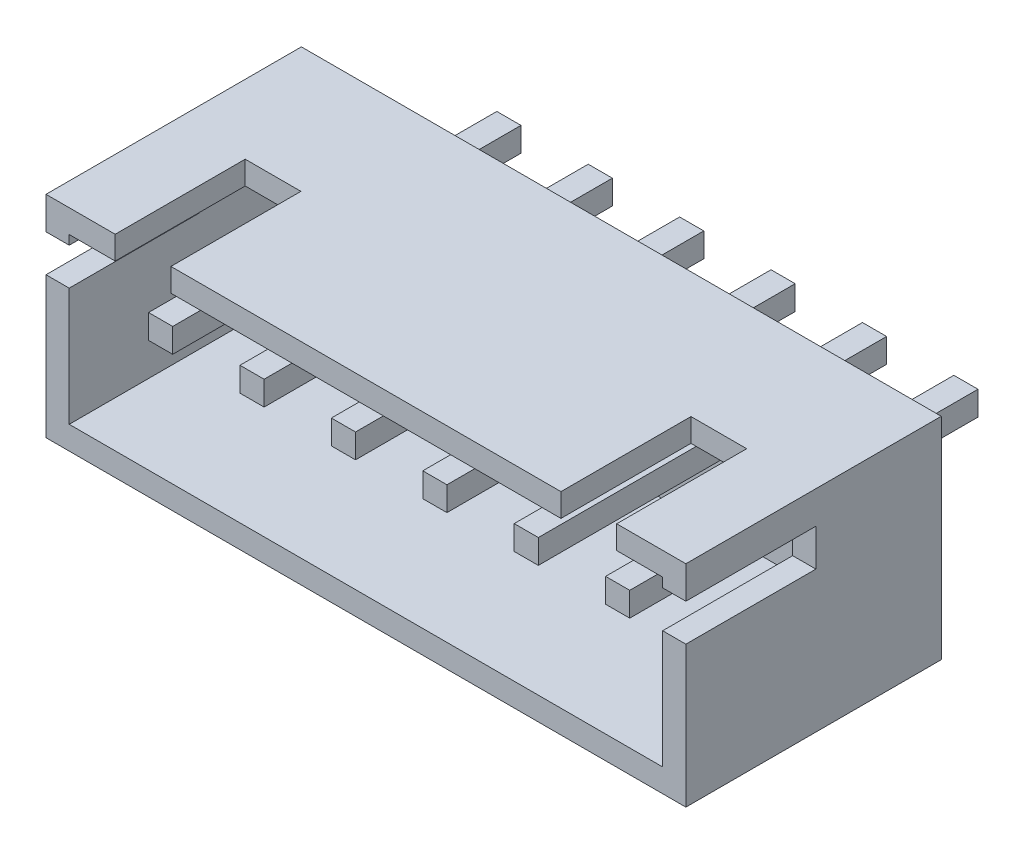
from build123d import *

# Parameters (mm, degrees)
SKETCH1_W           = 17.5006
SKETCH1_H           = 5.7658
BOSS_EXTRUDE1_DEPTH = 6.985
SKETCH2_W           = 0.6604
SKETCH2_H           = 0.6604
BOSS_EXTRUDE2_DEPTH = 3.175
SKETCH4_W           = 16.2306
SKETCH4_H           = 4.4958
CUT_EXTRUDE1_DEPTH  = 6.35
SKETCH2_2_W         = 0.6604
SKETCH2_2_H         = 0.6604
BOSS_EXTRUDE3_DEPTH = 6.35
SKETCH5_W           = 0.635
SKETCH5_H           = 1.016
SKETCH5_W_2         = 1.524
SKETCH5_H_2         = 0.635
CUT_EXTRUDE2_DEPTH  = 3.556


with BuildPart() as part:
    # Sketch1 → Boss-Extrude1 (new body)
    with BuildSketch(Plane.XY):
        with Locations((8.7503, 2.8829)):
            Rectangle(SKETCH1_W, SKETCH1_H)
    extrude(amount=BOSS_EXTRUDE1_DEPTH)

    # Sketch2 → Boss-Extrude2 (add)
    with BuildSketch(Plane(origin=(0, 0, 0), x_dir=(-1, 0, 0), z_dir=(0, 0, -1))):
        with Locations((-12.5003, 3.4036)):
            Rectangle(SKETCH2_W, SKETCH2_H)
        with Locations((-10.0003, 3.4036)):
            Rectangle(SKETCH2_W, SKETCH2_H)
        with Locations((-7.5003, 3.4036)):
            Rectangle(SKETCH2_W, SKETCH2_H)
        with Locations((-5.0003, 3.4036)):
            Rectangle(SKETCH2_W, SKETCH2_H)
        with Locations((-15.0003, 3.4036)):
            Rectangle(SKETCH2_W, SKETCH2_H)
        with Locations((-2.5003, 3.4036)):
            Rectangle(SKETCH2_W, SKETCH2_H)
    extrude(amount=BOSS_EXTRUDE2_DEPTH)

    # Sketch4 → Cut-Extrude1 (cut)
    with BuildSketch(Plane.XY.offset(6.985)):
        with Locations((8.7503, 2.8829)):
            Rectangle(SKETCH4_W, SKETCH4_H)
    extrude(amount=-CUT_EXTRUDE1_DEPTH, mode=Mode.SUBTRACT)

    # Sketch2<2> → Boss-Extrude3 (add)
    with BuildSketch(Plane(origin=(0, 0, 0), x_dir=(-1, 0, 0), z_dir=(0, 0, -1))):
        with Locations((-12.5003, 3.4036)):
            Rectangle(SKETCH2_2_W, SKETCH2_2_H)
        with Locations((-10.0003, 3.4036)):
            Rectangle(SKETCH2_2_W, SKETCH2_2_H)
        with Locations((-7.5003, 3.4036)):
            Rectangle(SKETCH2_2_W, SKETCH2_2_H)
        with Locations((-5.0003, 3.4036)):
            Rectangle(SKETCH2_2_W, SKETCH2_2_H)
        with Locations((-15.0003, 3.4036)):
            Rectangle(SKETCH2_2_W, SKETCH2_2_H)
        with Locations((-2.5003, 3.4036)):
            Rectangle(SKETCH2_2_W, SKETCH2_2_H)
    extrude(amount=-BOSS_EXTRUDE3_DEPTH)

    # Sketch5 → Cut-Extrude2 (cut)
    with BuildSketch(Plane.XY.offset(6.985)):
        with Locations((0.3175, 4.3688)):
            Rectangle(SKETCH5_W, SKETCH5_H)
        with Locations((17.1831, 4.3688)):
            Rectangle(SKETCH5_W, SKETCH5_H)
        with Locations((14.8463, 5.4483)):
            Rectangle(SKETCH5_W_2, SKETCH5_H_2)
        with Locations((2.6543, 5.4483)):
            Rectangle(SKETCH5_W_2, SKETCH5_H_2)
    extrude(amount=-CUT_EXTRUDE2_DEPTH, mode=Mode.SUBTRACT)


solid = part.part
